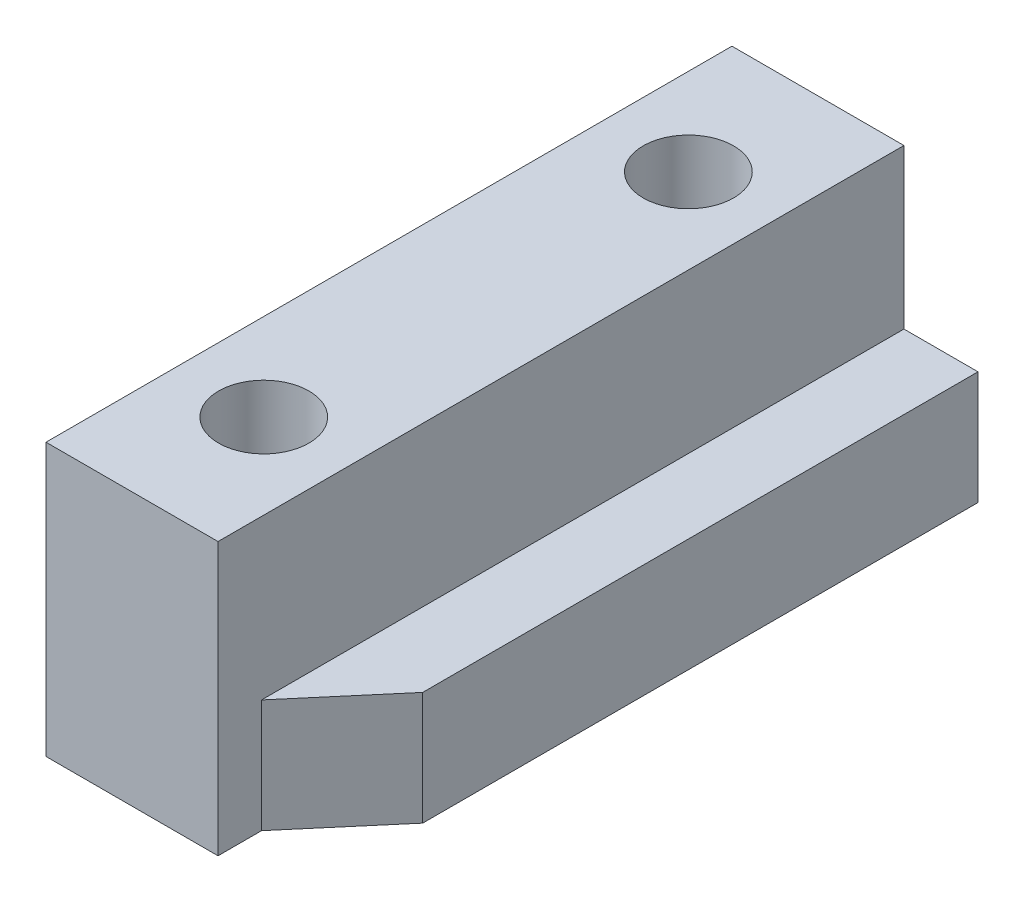
from build123d import *

# Parameters (mm, degrees)
BOSS_EXTRUDE1_DEPTH = 31.5
SKETCH2_R           = 2.075
CUT_EXTRUDE1_DEPTH  = 7
CUT_EXTRUDE2_DEPTH  = 10


with BuildPart() as part:
    # Sketch1 → Boss-Extrude1 (new body)
    with BuildSketch(Plane.XY):
        Polygon((0, 0), (0, 12.5), (7.9, 12.5), (7.9, 5.2), (11.3, 5.2), (11.3, 0), align=None)
    extrude(amount=-BOSS_EXTRUDE1_DEPTH)

    # Sketch2 → Cut-Extrude1 (cut)
    with BuildSketch(Plane(origin=(0, 12.5, 0), x_dir=(1, 0, 0), z_dir=(0, 1, 0))):
        with Locations(Location((4, 6, 0), (0, 0, 270))):
            Circle(SKETCH2_R)
        with Locations(Location((4, 25.5, 0), (0, 0, 270))):
            Circle(SKETCH2_R)
    extrude(amount=-CUT_EXTRUDE1_DEPTH, mode=Mode.SUBTRACT)

    # Sketch3 → Cut-Extrude2 (cut)
    with BuildSketch(Plane.XZ):
        Polygon((7.9, -2), (7.9, 0), (11.3, 0), (11.3, -6), align=None)
    extrude(amount=-CUT_EXTRUDE2_DEPTH, mode=Mode.SUBTRACT)


solid = part.part
